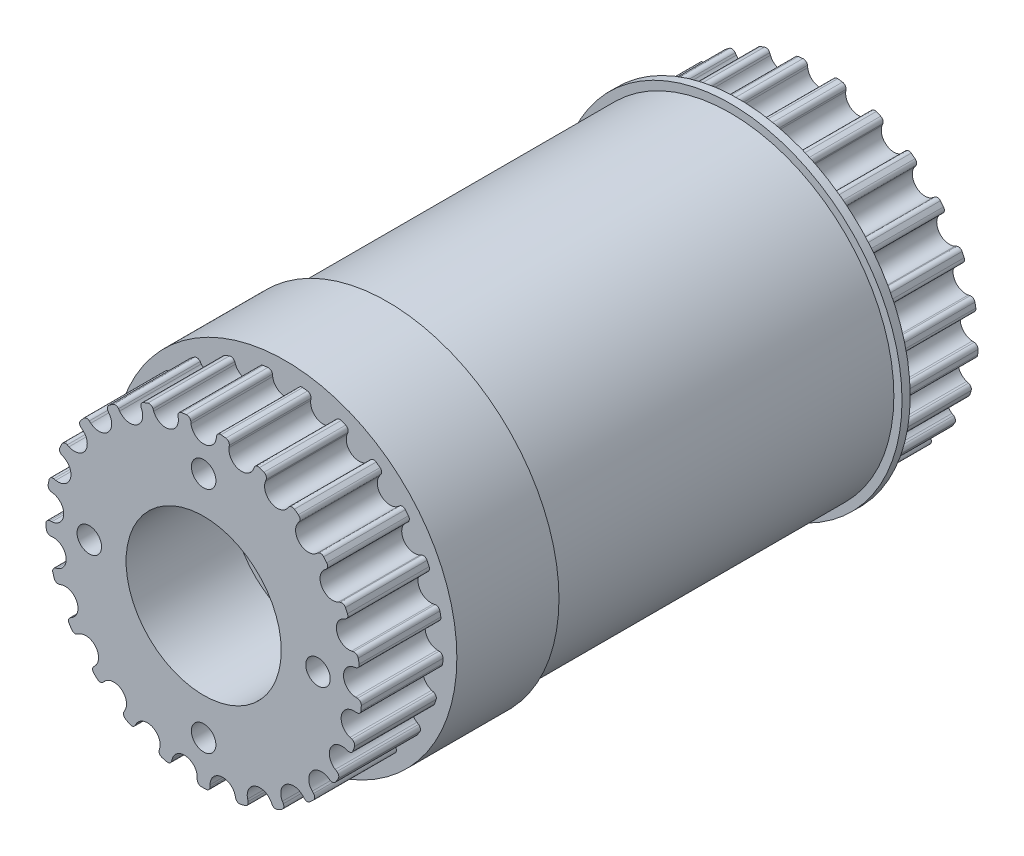
from build123d import *

# Parameters (mm, degrees)
SKETCH_1_R               = 19.894367886
EXTRUDE_1_DEPTH          = 75.5
CUT_EXTRUDE_1_DEPTH      = 81.571842149
PATTERN_CIRCULAR_1_COUNT = 25
SKETCH_3_R               = 21
EXTRUDE_2_DEPTH          = 1
SKETCH_4_R               = 20
EXTRUDE_3_DEPTH          = 42
SKETCH_5_R               = 21
EXTRUDE_4_DEPTH          = 12.5
SKETCH_6_R               = 5.2
CUT_EXTRUDE_2_DEPTH      = 82.131066799
SKETCH_6_3_R             = 9.5
SKETCH_6_3_R_2           = 5.2
CUT_EXTRUDE_3_DEPTH      = 13
CUT_EXTRUDE_START        = -62.5
SKETCH_6_4_R             = 9.5
SKETCH_6_4_R_2           = 5.2
CUT_EXTRUDE_4_DEPTH      = 13
SKETCH_7_R               = 1.5
CUT_EXTRUDE_5_DEPTH      = 82.131066799


with BuildPart() as part:
    # 草图1 → 凸台-拉伸1 (new body)
    with BuildSketch(Plane.XY):
        Circle(SKETCH_1_R)
    extrude(amount=EXTRUDE_1_DEPTH)

    # 草图2 → 切除-拉伸1 (cut, through all)
    with BuildSketch(Plane.XY.offset(75.5)):
        with BuildLine():
            Line((1.577407148, 18.768724044), (1.548371997, 18.532251711))
            ThreePointArc((1.548371997, 18.532251711), (0, 17.162367886), (-1.548371997, 18.532251711))
            Line((-1.548371997, 18.532251711), (-1.577407148, 18.768724044))
            ThreePointArc((-1.577407148, 18.768724044), (-1.763534561, 19.099975129), (-2.128765754, 19.204745692))
            ThreePointArc((-2.128765754, 19.204745692), (-2.275316606, 19.187934623), (-2.421734847, 19.170005244))
            Line((-2.421734847, 19.170005244), (-2.493425457, 19.737494854))
            ThreePointArc((-2.493425457, 19.737494854), (0, 19.894367886), (2.493425457, 19.737494854))
            Line((2.493425457, 19.737494854), (2.421734847, 19.170005244))
            ThreePointArc((2.421734847, 19.170005244), (2.275316606, 19.187934623), (2.128765754, 19.204745692))
            ThreePointArc((2.128765754, 19.204745692), (1.763534561, 19.099975129), (1.577407148, 18.768724044))
        make_face()
    cut_extrude_1 = extrude(amount=-CUT_EXTRUDE_1_DEPTH, mode=Mode.SUBTRACT)

    # 阵列(圆周)1: 切除-拉伸1 ×25 about axis
    pattern_circular_1_axis = Axis((0, 0, 0), (0, 0, 1))
    for i in range(1, PATTERN_CIRCULAR_1_COUNT):
        add(cut_extrude_1.rotate(pattern_circular_1_axis, i * 360 / PATTERN_CIRCULAR_1_COUNT), mode=Mode.SUBTRACT)

    # 草图3 → 凸台-拉伸2 (add)
    with BuildSketch(Plane(origin=(0, 0, 10), x_dir=(-1, 0, 0), z_dir=(0, 0, -1))):
        Circle(SKETCH_3_R)
    extrude(amount=-EXTRUDE_2_DEPTH)

    # 草图4 → 凸台-拉伸3 (add)
    with BuildSketch(Plane(origin=(0, 0, 11), x_dir=(-1, 0, 0), z_dir=(0, 0, -1))):
        Circle(SKETCH_4_R)
    extrude(amount=-EXTRUDE_3_DEPTH)

    # 草图5 → 凸台-拉伸4 (add)
    with BuildSketch(Plane(origin=(0, 0, 53), x_dir=(-1, 0, 0), z_dir=(0, 0, -1))):
        Circle(SKETCH_5_R)
    extrude(amount=-EXTRUDE_4_DEPTH)

    # 草图6 → 切除-拉伸2 (cut, through all)
    with BuildSketch(Plane(origin=(0, 0, 0), x_dir=(-1, 0, 0), z_dir=(0, 0, -1))):
        Circle(SKETCH_6_R)
    extrude(amount=-CUT_EXTRUDE_2_DEPTH, mode=Mode.SUBTRACT)

    # 草图6<3> → 切除-拉伸3 (cut)
    with BuildSketch(Plane(origin=(0, 0, 0), x_dir=(-1, 0, 0), z_dir=(0, 0, -1))):
        Circle(SKETCH_6_3_R)
        Circle(SKETCH_6_3_R_2, mode=Mode.SUBTRACT)
    extrude(amount=-CUT_EXTRUDE_3_DEPTH, mode=Mode.SUBTRACT)

    # 草图6<4> → 切除-拉伸4 (cut)
    with BuildSketch(Plane(origin=(0, 0, 0), x_dir=(-1, 0, 0), z_dir=(0, 0, -1)).offset(CUT_EXTRUDE_START)):
        Circle(SKETCH_6_4_R)
        Circle(SKETCH_6_4_R_2, mode=Mode.SUBTRACT)
    extrude(amount=-CUT_EXTRUDE_4_DEPTH, mode=Mode.SUBTRACT)

    # 草图7 → 切除-拉伸5 (cut, through all)
    with BuildSketch(Plane(origin=(0, 0, 0), x_dir=(-1, 0, 0), z_dir=(0, 0, -1))):
        with Locations((0, 14)):
            Circle(SKETCH_7_R)
        with Locations((14, 0)):
            Circle(SKETCH_7_R)
        with Locations((0, -14)):
            Circle(SKETCH_7_R)
        with Locations((-14, 0)):
            Circle(SKETCH_7_R)
    extrude(amount=-CUT_EXTRUDE_5_DEPTH, mode=Mode.SUBTRACT)


solid = part.part
